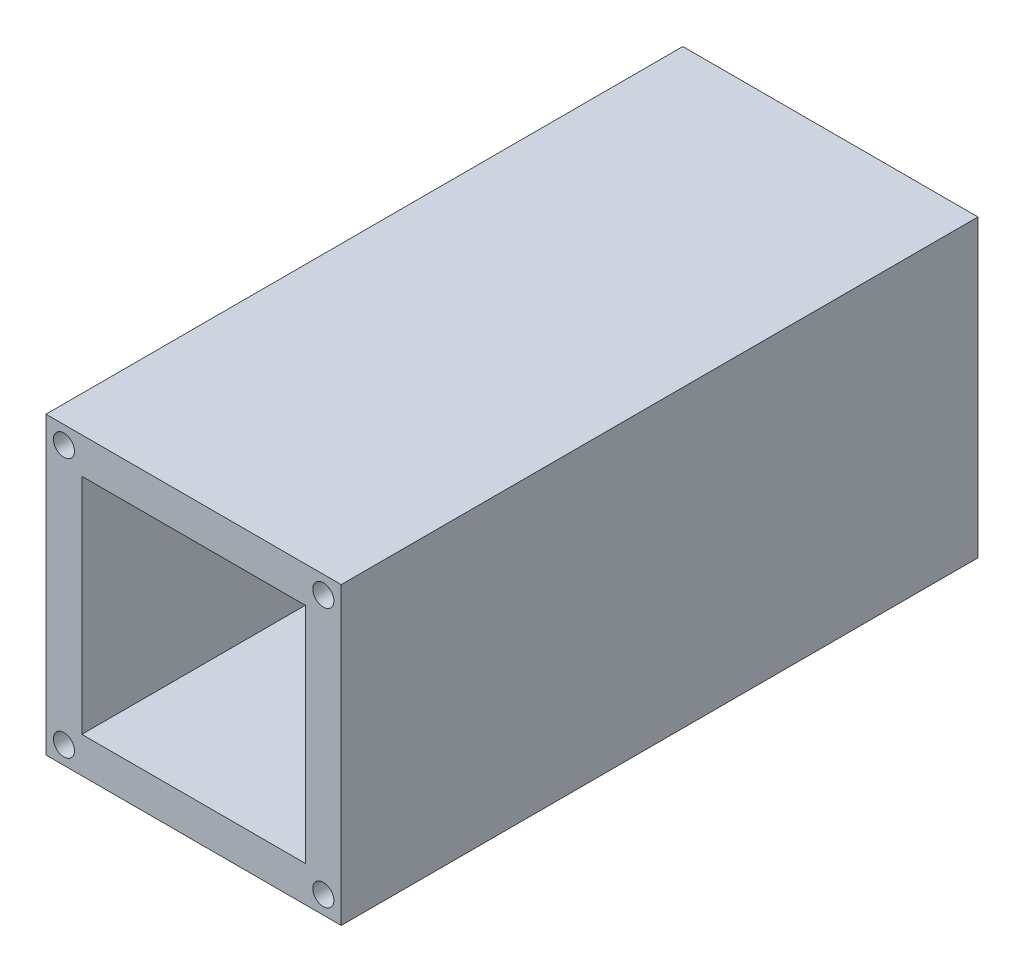
from build123d import *

# Parameters (mm, degrees)
CROQUIS1_W              = 35
CROQUIS1_H              = 35
SALIENTE_EXTRUIR2_DEPTH = 75.5
CROQUIS2_W              = 26.5
CROQUIS2_H              = 26.5
CORTAR_EXTRUIR1_DEPTH   = 80
CROQUIS4_R              = 1.25
CORTAR_EXTRUIR2_DEPTH   = 10
CORTAR_EXTRUIR5_START   = -10
CROQUIS9_R              = 1.25
CORTAR_EXTRUIR5_DEPTH   = 10
CROQUIS11_W             = 26.5
CROQUIS11_H             = 26.5
SALIENTE_EXTRUIR3_DEPTH = 37
CROQUIS13_W             = 26.5
CROQUIS13_H             = 26.5
CORTAR_EXTRUIR6_DEPTH   = 30
CORTAR_EXTRUIR7_REACH   = 47.768


with BuildPart() as part:
    # Croquis1 → Saliente-Extruir2 (new body)
    with BuildSketch(Plane.XY):
        Rectangle(CROQUIS1_W, CROQUIS1_H)
    extrude(amount=SALIENTE_EXTRUIR2_DEPTH)

    # Croquis2 → Cortar-Extruir1 (cut)
    with BuildSketch(Plane.XY.offset(75.5)):
        Rectangle(CROQUIS2_W, CROQUIS2_H)
    extrude(amount=-CORTAR_EXTRUIR1_DEPTH, mode=Mode.SUBTRACT)

    # Croquis4 → Cortar-Extruir2 (cut)
    with BuildSketch(Plane.XY.offset(75.5)):
        with Locations((-15.375, 15.38)):
            Circle(CROQUIS4_R)
        with Locations((15.38, 15.38)):
            Circle(CROQUIS4_R)
        with Locations((15.38, -15.38)):
            Circle(CROQUIS4_R)
        with Locations((-15.375, -15.38)):
            Circle(CROQUIS4_R)
    extrude(amount=-CORTAR_EXTRUIR2_DEPTH, mode=Mode.SUBTRACT)

    # Croquis9 → Cortar-Extruir5 (cut)
    with BuildSketch(Plane(origin=(0, 0, 0), x_dir=(-1, 0, 0), z_dir=(0, 0, -1)).offset(CORTAR_EXTRUIR5_START)):
        with Locations(Location((-15.38, 15.38, 0), (0, 0, 180))):
            Circle(CROQUIS9_R)
        with Locations((15.38, 15.38)):
            Circle(CROQUIS9_R)
        with Locations((15.38, -15.38)):
            Circle(CROQUIS9_R)
        with Locations(Location((-15.38, -15.38, 0), (0, 0, 180))):
            Circle(CROQUIS9_R)
    extrude(amount=CORTAR_EXTRUIR5_DEPTH, mode=Mode.SUBTRACT)

    # Croquis11 → Saliente-Extruir3 (add)
    with BuildSketch(Plane(origin=(0, 0, 0), x_dir=(-1, 0, 0), z_dir=(0, 0, -1))):
        Rectangle(CROQUIS11_W, CROQUIS11_H)
    extrude(amount=-SALIENTE_EXTRUIR3_DEPTH)

    # Croquis13 → Cortar-Extruir6 (cut)
    with BuildSketch(Plane(origin=(0, 0, 0), x_dir=(-1, 0, 0), z_dir=(0, 0, -1))):
        Rectangle(CROQUIS13_W, CROQUIS13_H)
    extrude(amount=-CORTAR_EXTRUIR6_DEPTH, mode=Mode.SUBTRACT)

    # Croquis14 → Cortar-Extruir7 (cut, up to next)
    with BuildSketch(Plane.XY.offset(37), mode=Mode.PRIVATE) as cortar_extruir7_sk1:
        with BuildLine():
            Line((13.25, -5.072292803), (13.25, 0))
            Line((13.25, 0), (-13.25, 0))
            Line((-13.25, 0), (-13.25, -5.072292803))
            Line((-13.25, -5.072292803), (-8.314710179, -8.652490661))
            ThreePointArc((-8.314710179, -8.652490661), (0, -11.350749828), (8.314710179, -8.652490661))
            Line((8.314710179, -8.652490661), (13.25, -5.072292803))
        make_face()
    cortar_extruir7_tool1 = extrude(cortar_extruir7_sk1.sketch, amount=-CORTAR_EXTRUIR7_REACH, mode=Mode.PRIVATE) & part.part
    # Croquis14 → Cortar-Extruir7 (cut, up to next)
    with BuildSketch(Plane.XY.offset(37), mode=Mode.PRIVATE) as cortar_extruir7_sk2:
        with BuildLine():
            Line((-13.25, 0), (13.25, 0))
            Line((13.25, 0), (13.25, 4.999749994))
            Line((13.25, 4.999749994), (8.314710179, 8.652490661))
            ThreePointArc((8.314710179, 8.652490661), (0, 11.394764723), (-8.314710179, 8.652490661))
            Line((-8.314710179, 8.652490661), (-13.25, 4.999749994))
            Line((-13.25, 4.999749994), (-13.25, 0))
        make_face()
    cortar_extruir7_tool2 = extrude(cortar_extruir7_sk2.sketch, amount=-CORTAR_EXTRUIR7_REACH, mode=Mode.PRIVATE) & part.part
    add(cortar_extruir7_tool1.solids().sort_by_distance((0, -4.780438, 37))[0], mode=Mode.SUBTRACT)
    add(cortar_extruir7_tool2.solids().sort_by_distance((0, 4.791209, 37))[0], mode=Mode.SUBTRACT)


solid = part.part
